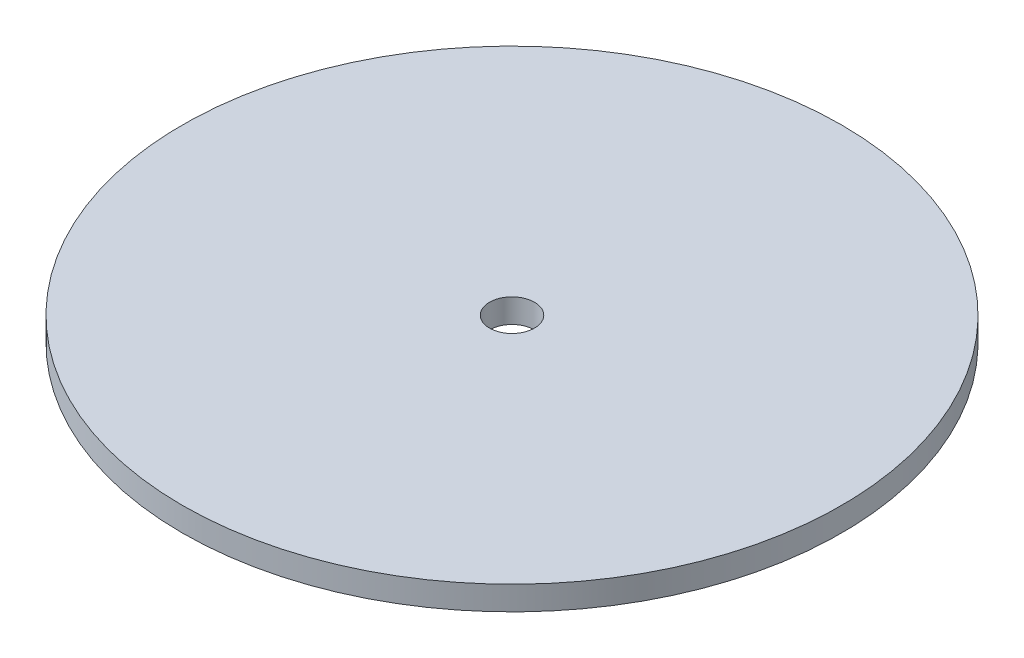
from build123d import *

# Parameters (mm, degrees)
SKETCH2_R           = 110
SKETCH2_R_2         = 11.25
SKETCH2_R_3         = 7.5
BOSS_EXTRUDE1_DEPTH = 5
BOSS_EXTRUDE2_START = 3
SKETCH1_R           = 110
SKETCH1_R_2         = 7.5
BOSS_EXTRUDE2_DEPTH = 3


with BuildPart() as part:
    # Sketch2 → Boss-Extrude1 (new body)
    with BuildSketch(Plane(origin=(0, 0, 0), x_dir=(1, 0, 0), z_dir=(0, 1, 0))):
        with Locations(Location((0, 0, 0), (0, 0, 270))):
            Circle(SKETCH2_R)
        with Locations(Location((0, 45, 0), (0, 0, 270))):
            Circle(SKETCH2_R_2, mode=Mode.SUBTRACT)
        with Locations(Location((22.5, 38.97114317, 0), (0, 0, 270))):
            Circle(SKETCH2_R_2, mode=Mode.SUBTRACT)
        with Locations(Location((38.97114317, 22.5, 0), (0, 0, 270))):
            Circle(SKETCH2_R_2, mode=Mode.SUBTRACT)
        with Locations(Location((45, 0, 0), (0, 0, 270))):
            Circle(SKETCH2_R_2, mode=Mode.SUBTRACT)
        with Locations(Location((38.97114317, -22.5, 0), (0, 0, 270))):
            Circle(SKETCH2_R_2, mode=Mode.SUBTRACT)
        with Locations(Location((22.5, -38.97114317, 0), (0, 0, 270))):
            Circle(SKETCH2_R_2, mode=Mode.SUBTRACT)
        with Locations(Location((0, -45, 0), (0, 0, 270))):
            Circle(SKETCH2_R_2, mode=Mode.SUBTRACT)
        with Locations(Location((-22.5, -38.97114317, 0), (0, 0, 270))):
            Circle(SKETCH2_R_2, mode=Mode.SUBTRACT)
        with Locations(Location((-38.97114317, -22.5, 0), (0, 0, 270))):
            Circle(SKETCH2_R_2, mode=Mode.SUBTRACT)
        with Locations(Location((-45, 0, 0), (0, 0, 270))):
            Circle(SKETCH2_R_2, mode=Mode.SUBTRACT)
        with Locations(Location((0, 0, 0), (0, 0, 270))):
            Circle(SKETCH2_R_3, mode=Mode.SUBTRACT)
        with Locations(Location((-38.97114317, 22.5, 0), (0, 0, 270))):
            Circle(SKETCH2_R_2, mode=Mode.SUBTRACT)
        with Locations(Location((-22.5, 38.97114317, 0), (0, 0, 270))):
            Circle(SKETCH2_R_2, mode=Mode.SUBTRACT)
        with Locations(Location((0, 90, 0), (0, 0, 270))):
            Circle(SKETCH2_R_2, mode=Mode.SUBTRACT)
        with Locations(Location((27.811529494, 85.595086467, 0), (0, 0, 270))):
            Circle(SKETCH2_R_2, mode=Mode.SUBTRACT)
        with Locations(Location((52.900672706, 72.811529494, 0), (0, 0, 270))):
            Circle(SKETCH2_R_2, mode=Mode.SUBTRACT)
        with Locations(Location((72.811529494, 52.900672706, 0), (0, 0, 270))):
            Circle(SKETCH2_R_2, mode=Mode.SUBTRACT)
        with Locations(Location((85.595086467, 27.811529494, 0), (0, 0, 270))):
            Circle(SKETCH2_R_2, mode=Mode.SUBTRACT)
        with Locations(Location((90, 0, 0), (0, 0, 270))):
            Circle(SKETCH2_R_2, mode=Mode.SUBTRACT)
        with Locations(Location((85.595086467, -27.811529494, 0), (0, 0, 270))):
            Circle(SKETCH2_R_2, mode=Mode.SUBTRACT)
        with Locations(Location((72.811529494, -52.900672706, 0), (0, 0, 270))):
            Circle(SKETCH2_R_2, mode=Mode.SUBTRACT)
        with Locations(Location((52.900672706, -72.811529494, 0), (0, 0, 270))):
            Circle(SKETCH2_R_2, mode=Mode.SUBTRACT)
        with Locations(Location((27.811529494, -85.595086467, 0), (0, 0, 270))):
            Circle(SKETCH2_R_2, mode=Mode.SUBTRACT)
        with Locations(Location((0, -90, 0), (0, 0, 270))):
            Circle(SKETCH2_R_2, mode=Mode.SUBTRACT)
        with Locations(Location((-27.811529494, -85.595086467, 0), (0, 0, 270))):
            Circle(SKETCH2_R_2, mode=Mode.SUBTRACT)
        with Locations(Location((-52.900672706, -72.811529494, 0), (0, 0, 270))):
            Circle(SKETCH2_R_2, mode=Mode.SUBTRACT)
        with Locations(Location((-72.811529494, -52.900672706, 0), (0, 0, 270))):
            Circle(SKETCH2_R_2, mode=Mode.SUBTRACT)
        with Locations(Location((-85.595086467, -27.811529494, 0), (0, 0, 270))):
            Circle(SKETCH2_R_2, mode=Mode.SUBTRACT)
        with Locations(Location((-90, 0, 0), (0, 0, 270))):
            Circle(SKETCH2_R_2, mode=Mode.SUBTRACT)
        with Locations(Location((-85.595086467, 27.811529494, 0), (0, 0, 270))):
            Circle(SKETCH2_R_2, mode=Mode.SUBTRACT)
        with Locations(Location((-72.811529494, 52.900672706, 0), (0, 0, 270))):
            Circle(SKETCH2_R_2, mode=Mode.SUBTRACT)
        with Locations(Location((-52.900672706, 72.811529494, 0), (0, 0, 270))):
            Circle(SKETCH2_R_2, mode=Mode.SUBTRACT)
        with Locations(Location((-27.811529494, 85.595086467, 0), (0, 0, 270))):
            Circle(SKETCH2_R_2, mode=Mode.SUBTRACT)
    extrude(amount=-BOSS_EXTRUDE1_DEPTH)

    # Sketch1 → Boss-Extrude2 (add)
    with BuildSketch(Plane(origin=(0, 0, 0), x_dir=(1, 0, 0), z_dir=(0, 1, 0)).offset(BOSS_EXTRUDE2_START)):
        with Locations(Location((0, 0, 0), (0, 0, 270))):
            Circle(SKETCH1_R)
        with Locations(Location((0, 0, 0), (0, 0, 270))):
            Circle(SKETCH1_R_2, mode=Mode.SUBTRACT)
    extrude(amount=-BOSS_EXTRUDE2_DEPTH)


solid = part.part
